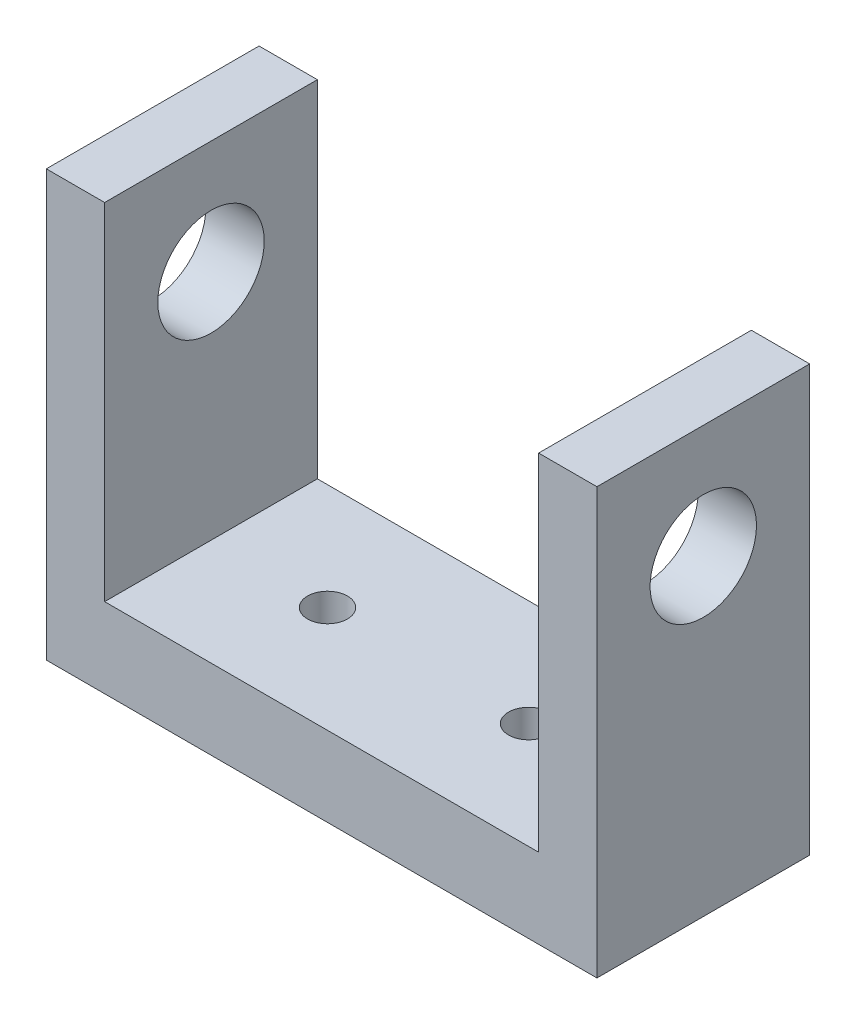
from build123d import *

# Parameters (mm, degrees)
SKETCH1_W             = 16.435294118
SKETCH1_H             = 6.35
BOSS_EXTRUDE1_DEPTH   = 12.7
SKETCH2_W             = 12.954
SKETCH2_H             = 6.35
CUT_EXTRUDE1_DEPTH    = 10.31875
SKETCH3_R             = 1.5875
CUT_EXTRUDE2_DEPTH    = 22.011651952
F_0_80_TAPPED_HOLE1_D = 1.19126


with BuildPart() as part:
    # Sketch1 → Boss-Extrude1 (new body)
    with BuildSketch(Plane(origin=(0, 0, 0), x_dir=(1, 0, 0), z_dir=(0, 1, 0))):
        Rectangle(SKETCH1_W, SKETCH1_H)
    extrude(amount=BOSS_EXTRUDE1_DEPTH)

    # Sketch2 → Cut-Extrude1 (cut)
    with BuildSketch(Plane(origin=(0, 12.7, 0), x_dir=(-1, 0, 0), z_dir=(0, 1, 0))):
        Rectangle(SKETCH2_W, SKETCH2_H)
    extrude(amount=-CUT_EXTRUDE1_DEPTH, mode=Mode.SUBTRACT)

    # Sketch3 → Cut-Extrude2 (cut, through all)
    with BuildSketch(Plane(origin=(8.217647059, 0, 0), x_dir=(0, 0, -1), z_dir=(1, 0, 0))):
        with Locations((0, 9.3218)):
            Circle(SKETCH3_R)
    extrude(amount=-CUT_EXTRUDE2_DEPTH, mode=Mode.SUBTRACT)

    # #0-80 Tapped Hole1 (through all)
    with Locations(Plane(origin=(0, 2.38125, 0), x_dir=(-1, 0, 0), z_dir=(0, 1, 0))):
        with Locations((3, 0), (-3, 0)):
            Hole(F_0_80_TAPPED_HOLE1_D / 2)


solid = part.part
